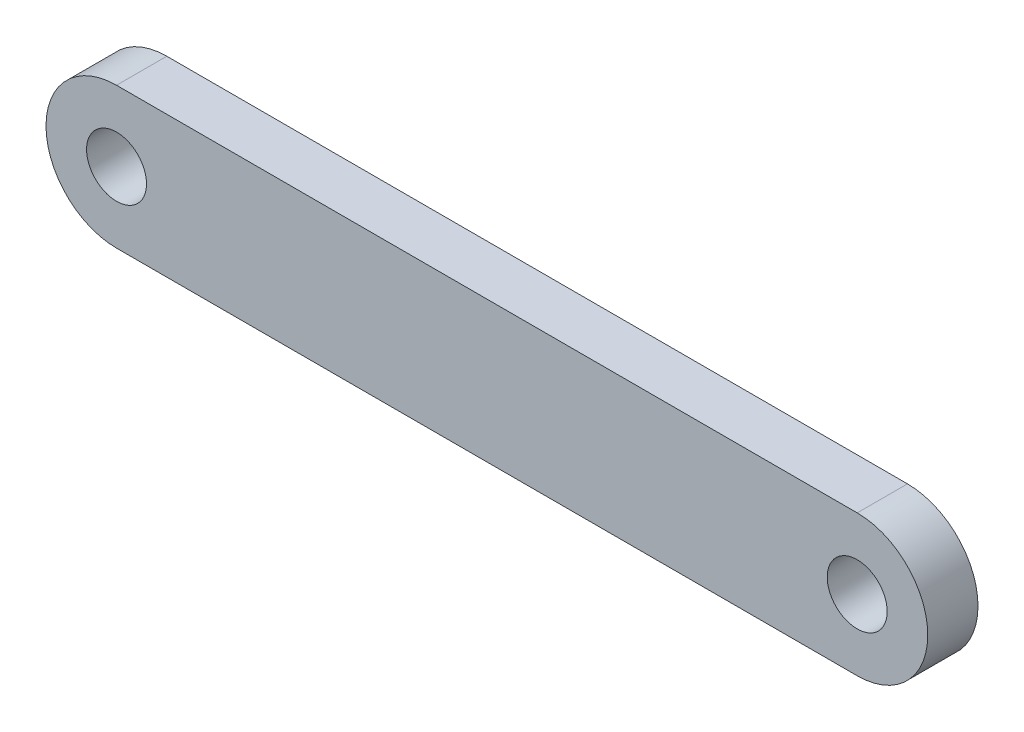
from build123d import *

# Parameters (mm, degrees)
SKETCH1_W           = 50
SKETCH1_H           = 8
BOSS_EXTRUDE1_DEPTH = 2.85
CUT_EXTRUDE1_DEPTH  = 26.477882565
SKETCH3_R           = 1.7
CUT_EXTRUDE2_DEPTH  = 26.477882565


with BuildPart() as part:
    # Sketch1 → Boss-Extrude1 (new body)
    with BuildSketch(Plane.XY):
        Rectangle(SKETCH1_W, SKETCH1_H)
    extrude(amount=BOSS_EXTRUDE1_DEPTH)

    # Sketch2 → Cut-Extrude1 (cut, through all)
    with BuildSketch(Plane.XY.offset(2.85)):
        with BuildLine():
            Line((21, -4), (26, -4))
            Line((26, -4), (26, 4))
            Line((26, 4), (21, 4))
            ThreePointArc((21, 4), (25, 0), (21, -4))
        make_face()
    cut_extrude1 = extrude(amount=-CUT_EXTRUDE1_DEPTH, mode=Mode.SUBTRACT)

    # Sketch3 → Cut-Extrude2 (cut, through all)
    with BuildSketch(Plane.XY.offset(2.85)):
        with Locations((21, 0)):
            Circle(SKETCH3_R)
    cut_extrude2 = extrude(amount=-CUT_EXTRUDE2_DEPTH, mode=Mode.SUBTRACT)

    # Mirror1: Cut-Extrude1, Cut-Extrude2 across plane
    add(cut_extrude1.mirror(Plane(origin=(0, 0, 0), x_dir=(0, 0, 1), z_dir=(1, 0, 0))), mode=Mode.SUBTRACT)
    add(cut_extrude2.mirror(Plane(origin=(0, 0, 0), x_dir=(0, 0, 1), z_dir=(1, 0, 0))), mode=Mode.SUBTRACT)


solid = part.part
